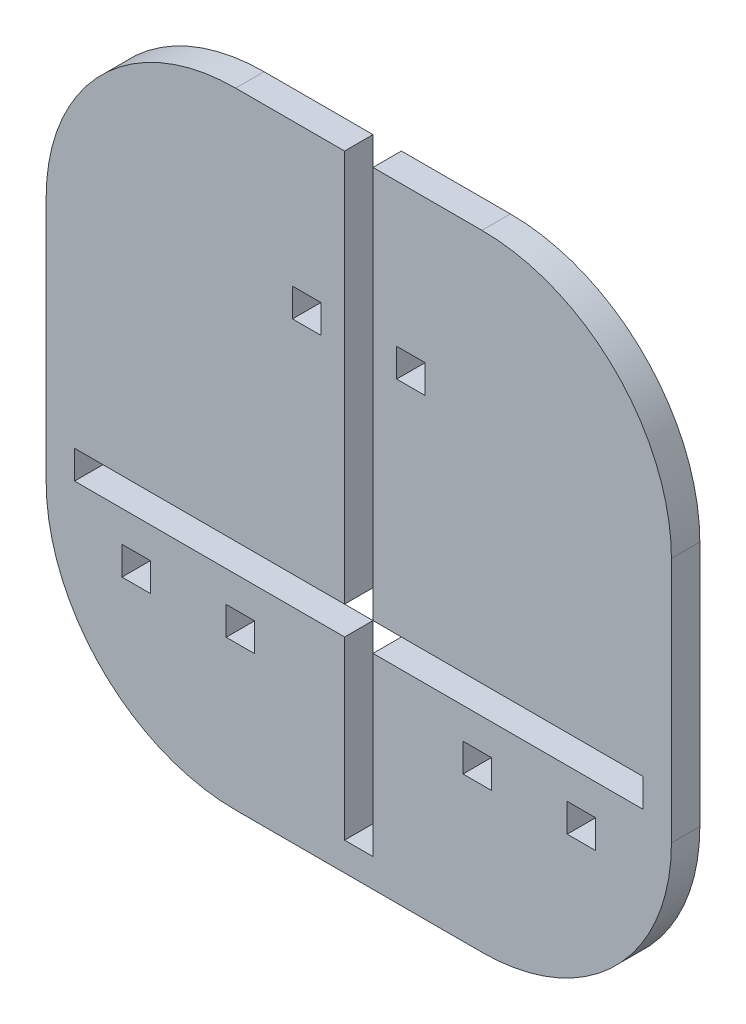
from build123d import *

# Parameters (mm, degrees)
CROQUIS1_W              = 3
CROQUIS1_H              = 3
SALIENTE_EXTRUIR1_DEPTH = 3


with BuildPart() as part:
    # Croquis1 → Saliente-Extruir1 (new body)
    with BuildSketch(Plane.XY):
        with BuildLine():
            Line((-30, -11.425), (-30, -8.425))
            Line((-30, -8.425), (-1.5, -8.425))
            Line((-1.5, -8.425), (-1.5, 30))
            Line((-1.5, 30), (-1.5, 33))
            Line((-1.5, 33), (-13, 33))
            ThreePointArc((-13, 33), (-27.142135624, 27.142135624), (-33, 13))
            Line((-33, 13), (-33, -13))
            ThreePointArc((-33, -13), (-27.142135624, -27.142135624), (-13, -33))
            Line((-13, -33), (13, -33))
            ThreePointArc((13, -33), (27.142135624, -27.142135624), (33, -13))
            Line((33, -13), (33, 13))
            ThreePointArc((33, 13), (27.142135624, 27.142135624), (13, 33))
            Line((13, 33), (1.5, 33))
            Line((1.5, 33), (1.5, 30))
            Line((1.5, 30), (1.5, -8.425))
            Line((1.5, -8.425), (30, -8.425))
            Line((30, -8.425), (30, -11.425))
            Line((30, -11.425), (1.5, -11.425))
            Line((1.5, -11.425), (1.5, -30))
            Line((1.5, -30), (-1.5, -30))
            Line((-1.5, -30), (-1.5, -11.425))
            Line((-1.5, -11.425), (-30, -11.425))
        make_face()
        with Locations((-23.5, -16.2)):
            Rectangle(CROQUIS1_W, CROQUIS1_H, mode=Mode.SUBTRACT)
        with Locations((-12.5, -16.2)):
            Rectangle(CROQUIS1_W, CROQUIS1_H, mode=Mode.SUBTRACT)
        with Locations((12.5, -16.2)):
            Rectangle(CROQUIS1_W, CROQUIS1_H, mode=Mode.SUBTRACT)
        with Locations((23.5, -16.2)):
            Rectangle(CROQUIS1_W, CROQUIS1_H, mode=Mode.SUBTRACT)
        with Locations((-5.5, 16.4)):
            Rectangle(CROQUIS1_W, CROQUIS1_H, mode=Mode.SUBTRACT)
        with Locations((5.5, 16.4)):
            Rectangle(CROQUIS1_W, CROQUIS1_H, mode=Mode.SUBTRACT)
    extrude(amount=SALIENTE_EXTRUIR1_DEPTH)


solid = part.part
